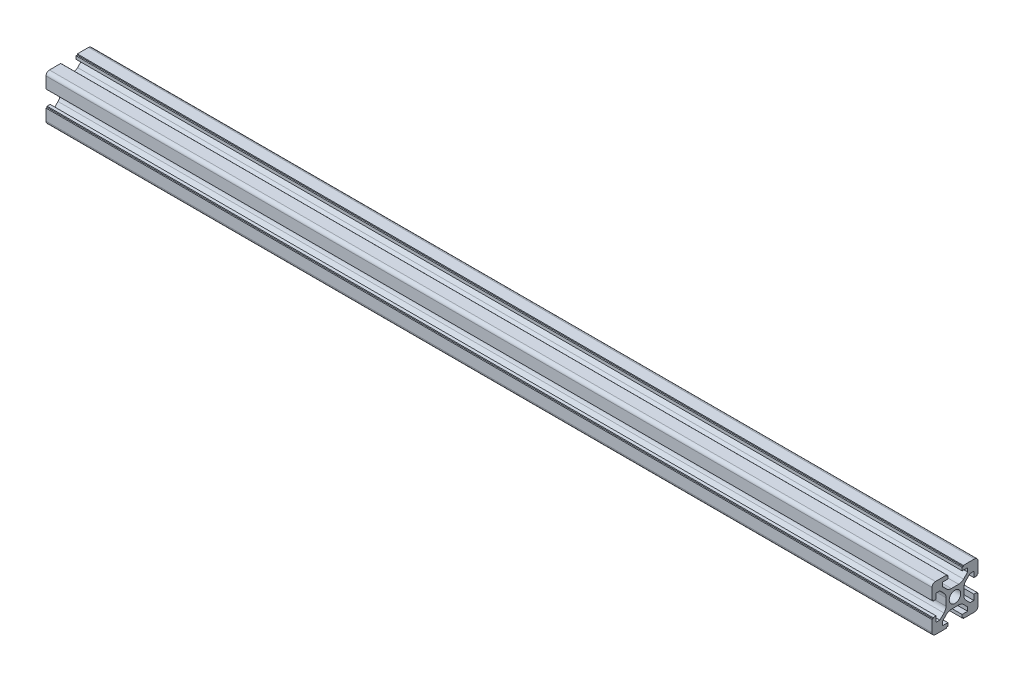
from build123d import *

# Parameters (mm, degrees)
EXTRUDE_1_DEPTH = 385
FILLET_1_R      = 1.5
FILLET_2_R      = 3


with BuildPart() as part:
    # 草图1 → 凸台-拉伸1 (new body)
    with BuildSketch(Plane(origin=(0, 0, 0), x_dir=(0, 0, -1), z_dir=(1, 0, 0))):
        Polygon((-10, 10), (-10, 3.6), (-9.530955747, 3.6), (-9.530955747, 3.1), (-8.2, 3.1), (-8.2, 5.5), (-6.560660172, 5.5), (-3.9, 2.839339828), (-3.9, 0), (-3.9, -2.839339828), (-6.560660172, -5.5), (-8.2, -5.5), (-8.2, -3.1), (-9.530955747, -3.1), (-9.530955747, -3.6), (-10, -3.6), (-10, -10), (-3.6, -10), (-3.6, -9.530955747), (-3.1, -9.530955747), (-3.1, -8.2), (-5.5, -8.2), (-5.5, -6.560660172), (-2.839339828, -3.9), (0, -3.9), (2.839339828, -3.9), (5.5, -6.560660172), (5.5, -8.2), (3.1, -8.2), (3.1, -9.530955747), (3.6, -9.530955747), (3.6, -10), (10, -10), (10, -3.6), (9.530955747, -3.6), (9.530955747, -3.1), (8.2, -3.1), (8.2, -5.5), (6.560660172, -5.5), (3.9, -2.839339828), (3.9, 0), (3.9, 2.839339828), (6.560660172, 5.5), (8.2, 5.5), (8.2, 3.1), (9.530955747, 3.1), (9.530955747, 3.6), (10, 3.6), (10, 10), (3.6, 10), (3.6, 9.530955747), (3.1, 9.530955747), (3.1, 8.2), (5.5, 8.2), (5.5, 6.560660172), (2.839339828, 3.9), (0, 3.9), (-2.839339828, 3.9), (-5.5, 6.560660172), (-5.5, 8.2), (-3.1, 8.2), (-3.1, 9.530955747), (-3.6, 9.530955747), (-3.6, 10), align=None)
        with BuildLine():
            ThreePointArc((0, 2.5), (-1.767766953, 1.767766953), (-2.5, 0))
            ThreePointArc((-2.5, 0), (-1.767766953, -1.767766953), (0, -2.5))
            ThreePointArc((0, -2.5), (1.767766953, -1.767766953), (2.5, 0))
            ThreePointArc((2.5, 0), (1.767766953, 1.767766953), (0, 2.5))
        make_face(mode=Mode.SUBTRACT)
    extrude(amount=EXTRUDE_1_DEPTH)

    # 圆角1
    fillet_1_edges = [part.edges().sort_by_distance(p)[0] for p in [
        (192.5, -10, -10),
        (192.5, -10, 10),
        (192.5, 10, 10),
        (192.5, 10, -10),
    ]]
    fillet(fillet_1_edges, radius=FILLET_1_R)

    # 圆角2
    fillet_2_edges = [part.edges().sort_by_distance(p)[0] for p in [
        (192.5, -3.9, -2.839339828),
        (192.5, -3.9, 2.839339828),
        (192.5, -2.839339828, 3.9),
        (192.5, 2.839339828, 3.9),
        (192.5, 3.9, 2.839339828),
        (192.5, 3.9, -2.839339828),
        (192.5, 2.839339828, -3.9),
        (192.5, -2.839339828, -3.9),
    ]]
    fillet(fillet_2_edges, radius=FILLET_2_R)


solid = part.part
